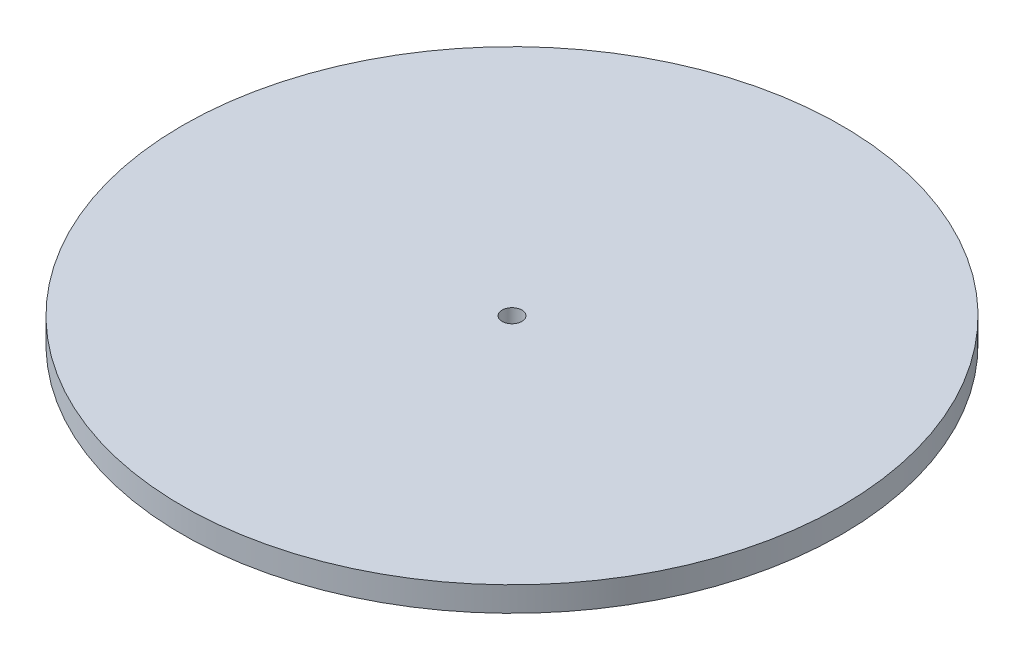
from build123d import *

# Parameters (mm, degrees)
SKETCH5_R          = 1.2
CUT_EXTRUDE1_DEPTH = 58.555399066


with BuildPart() as part:
    # Sketch3 → Revolve4 (revolve)
    with BuildSketch(Plane.XY, mode=Mode.PRIVATE) as revolve4_sk:
        with BuildLine():
            Line((1.2, 10.612443619), (1.2, 5.612443619))
            Line((1.2, 5.612443619), (0, 5.612443619))
            Line((0, 5.612443619), (0, 0))
            add(Edge.make_bspline(
                [(0, 0), (4.624999999, 0.000824343), (9.249999999, 0.387495016), (13.874999999, 1.187552176), (18.499999999, 2.169403699), (23.124999999, 3.230815768), (27.749999999, 4.349316242), (32.375, 5.479164551), (37, 6.612443619)],
                knots=[0.083414757, 0.083414757, 0.083414757, 0.083414757, 0.083414757, 0.083414757, 0.083414757, 0.083414757, 0.083414757, 0.917562329, 0.917562329, 0.917562329, 0.917562329, 0.917562329, 0.917562329, 0.917562329, 0.917562329, 0.917562329], degree=8))
            Line((37, 6.612443619), (37, 7.612443619))
            Line((37, 7.612443619), (40, 7.612443619))
            Line((40, 7.612443619), (40, 10.612443619))
            Line((40, 10.612443619), (1.2, 10.612443619))
        make_face()
    revolve(revolve4_sk.sketch.rotate(Axis((0, 10.612443619, 0), (0, -1, 0)), 180), axis=Axis((0, 10.612443619, 0), (0, -1, 0)))

    # Sketch5 → Cut-Extrude1 (cut, through all)
    with BuildSketch(Plane(origin=(0, 10.612443619, 0), x_dir=(1, 0, 0), z_dir=(0, 1, 0))):
        with Locations(Location((0, 0, 0), (0, 0, 180))):
            Circle(SKETCH5_R)
    extrude(amount=-CUT_EXTRUDE1_DEPTH, mode=Mode.SUBTRACT)


solid = part.part
